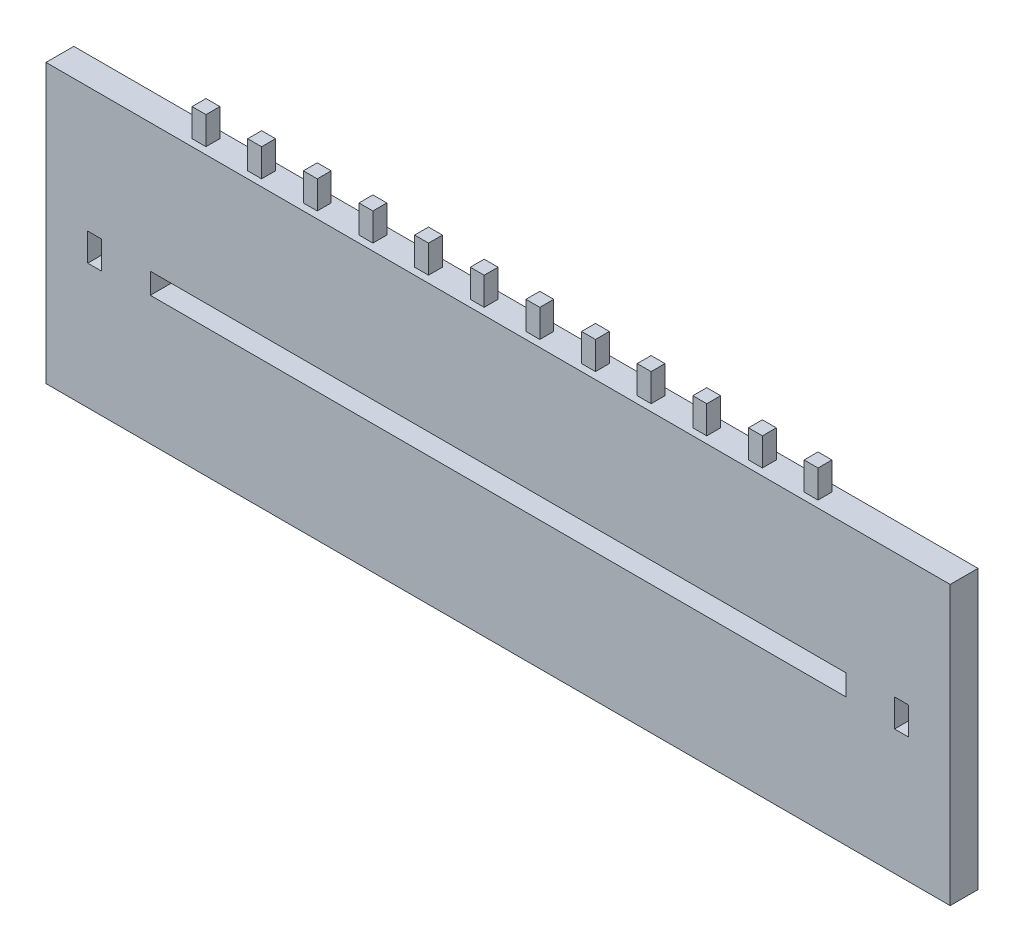
from build123d import *

# Parameters (mm, degrees)
SKETCH1_W           = 650
SKETCH1_H           = 200
SKETCH1_W_2         = 500
SKETCH1_H_2         = 15
SKETCH1_W_3         = 10
SKETCH1_H_3         = 20
BOSS_EXTRUDE1_DEPTH = 20
SKETCH2_W           = 10
SKETCH2_H           = 10
BOSS_EXTRUDE2_DEPTH = 20


with BuildPart() as part:
    # Sketch1 → Boss-Extrude1 (new body)
    with BuildSketch(Plane.XY):
        Rectangle(SKETCH1_W, SKETCH1_H)
        Rectangle(SKETCH1_W_2, SKETCH1_H_2, mode=Mode.SUBTRACT)
        with Locations((-290, 0)):
            Rectangle(SKETCH1_W_3, SKETCH1_H_3, mode=Mode.SUBTRACT)
        with Locations((290, 0)):
            Rectangle(SKETCH1_W_3, SKETCH1_H_3, mode=Mode.SUBTRACT)
    extrude(amount=BOSS_EXTRUDE1_DEPTH)

    # Sketch2 → Boss-Extrude2 (add)
    with BuildSketch(Plane(origin=(0, 100, 0), x_dir=(1, 0, 0), z_dir=(0, 1, 0))):
        with Locations((-180, -10)):
            Rectangle(SKETCH2_W, SKETCH2_H)
        with Locations((-220, -10)):
            Rectangle(SKETCH2_W, SKETCH2_H)
        with Locations((-140, -10)):
            Rectangle(SKETCH2_W, SKETCH2_H)
        with Locations((-100, -10)):
            Rectangle(SKETCH2_W, SKETCH2_H)
        with Locations((-60, -10)):
            Rectangle(SKETCH2_W, SKETCH2_H)
        with Locations((-20, -10)):
            Rectangle(SKETCH2_W, SKETCH2_H)
        with Locations((20, -10)):
            Rectangle(SKETCH2_W, SKETCH2_H)
        with Locations((60, -10)):
            Rectangle(SKETCH2_W, SKETCH2_H)
        with Locations((100, -10)):
            Rectangle(SKETCH2_W, SKETCH2_H)
        with Locations((140, -10)):
            Rectangle(SKETCH2_W, SKETCH2_H)
        with Locations((180, -10)):
            Rectangle(SKETCH2_W, SKETCH2_H)
        with Locations((220, -10)):
            Rectangle(SKETCH2_W, SKETCH2_H)
    extrude(amount=BOSS_EXTRUDE2_DEPTH)


solid = part.part
